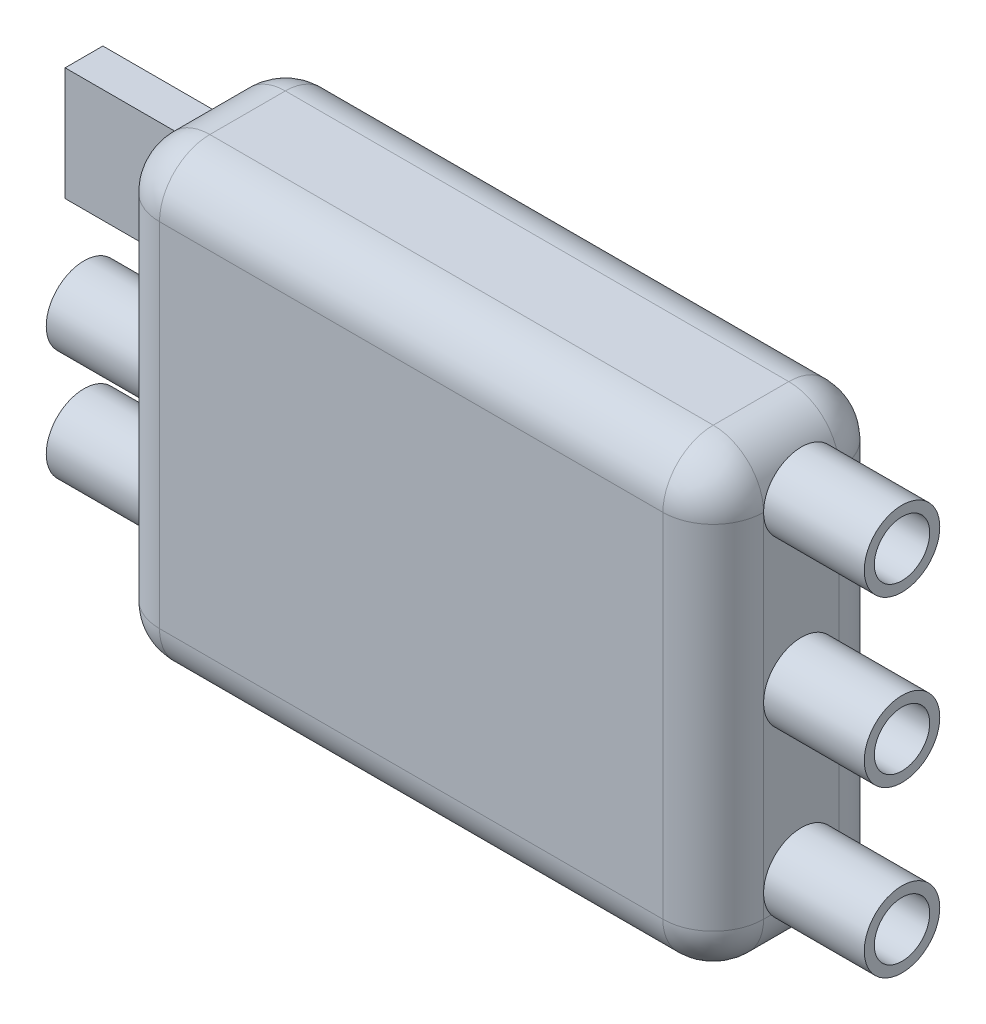
from build123d import *

# Parameters (mm, degrees)
BOSS_EXTRUDE1_DEPTH = 7
FILLET1_R           = 2
SKETCH3_R           = 1.5
SKETCH3_R_2         = 1.1
BOSS_EXTRUDE2_DEPTH = 4
SKETCH4_R           = 1.5
SKETCH4_R_2         = 0.640256745
SKETCH4_R_3         = 1.1
SKETCH4_W           = 1.5
SKETCH4_H           = 4.5
BOSS_EXTRUDE3_DEPTH = 4.5


with BuildPart() as part:
    # Sketch1 → Boss-Extrude1 (new body)
    with BuildSketch(Plane.XY):
        with BuildLine():
            Line((10, -9), (-10, -9))
            ThreePointArc((-10, -9), (-11.414213562, -8.414213562), (-12, -7))
            Line((-12, -7), (-12, 7))
            ThreePointArc((-12, 7), (-11.414213562, 8.414213562), (-10, 9))
            Line((-10, 9), (10, 9))
            ThreePointArc((10, 9), (11.414213562, 8.414213562), (12, 7))
            Line((12, 7), (12, -7))
            ThreePointArc((12, -7), (11.414213562, -8.414213562), (10, -9))
        make_face()
    extrude(amount=BOSS_EXTRUDE1_DEPTH)

    # Fillet1
    fillet1_edges = [part.edges().sort_by_distance(p)[0] for p in [
        (12, 0, 0),
        (11.414213562, -8.414213562, 0),
        (0, -9, 0),
        (-11.414213562, -8.414213562, 0),
        (11.414213562, -8.414213562, 7),
        (12, 0, 7),
        (11.414213562, 8.414213562, 7),
        (0, 9, 7),
        (-11.414213562, 8.414213562, 7),
        (-12, 0, 7),
        (-11.414213562, -8.414213562, 7),
        (-12, 0, 0),
        (0, -9, 7),
        (-11.414213562, 8.414213562, 0),
        (0, 9, 0),
        (11.414213562, 8.414213562, 0),
    ]]
    fillet(fillet1_edges, radius=FILLET1_R)

    # Sketch3 → Boss-Extrude2 (add)
    # profile 1 of 3: a face of its own
    with BuildSketch(Plane(origin=(12, 0, 0), x_dir=(0, 0, -1), z_dir=(1, 0, 0))):
        with Locations((-3.5, 7)):
            Circle(SKETCH3_R)
        with Locations((-3.5, 7)):
            Circle(SKETCH3_R_2, mode=Mode.SUBTRACT)
    # profile 2 of 3: a face of its own
    with BuildSketch(Plane(origin=(12, 0, 0), x_dir=(0, 0, -1), z_dir=(1, 0, 0))):
        with Locations((-3.5, 0.451158359)):
            Circle(SKETCH3_R)
        with Locations((-3.5, 0.451158359)):
            Circle(SKETCH3_R_2, mode=Mode.SUBTRACT)
    # profile 3 of 3: a face of its own
    with BuildSketch(Plane(origin=(12, 0, 0), x_dir=(0, 0, -1), z_dir=(1, 0, 0))):
        with Locations((-3.5, -6.097683282)):
            Circle(SKETCH3_R)
        with Locations(Location((-3.5, -6.097683282, 0), (0, 0, 235.113626632))):
            Circle(SKETCH3_R_2, mode=Mode.SUBTRACT)
    extrude(amount=BOSS_EXTRUDE2_DEPTH)

    # Sketch4 → Boss-Extrude3 (add)
    # profile 1 of 3: a face of its own
    with BuildSketch(Plane.ZY.offset(12)):
        with Locations((3.5, -0.844007622)):
            Circle(SKETCH4_R)
        with Locations((3.5, -0.844007622)):
            Circle(SKETCH4_R_2, mode=Mode.SUBTRACT)
    # profile 2 of 3: a face of its own
    with BuildSketch(Plane.ZY.offset(12)):
        with Locations((3.5, -5.244007622)):
            Circle(SKETCH4_R)
        with Locations((3.5, -5.244007622)):
            Circle(SKETCH4_R_3, mode=Mode.SUBTRACT)
    # profile 3 of 3: a face of its own
    with BuildSketch(Plane.ZY.offset(12)):
        with Locations((3.5, 5.420795306)):
            Rectangle(SKETCH4_W, SKETCH4_H)
    extrude(amount=BOSS_EXTRUDE3_DEPTH)


solid = part.part
